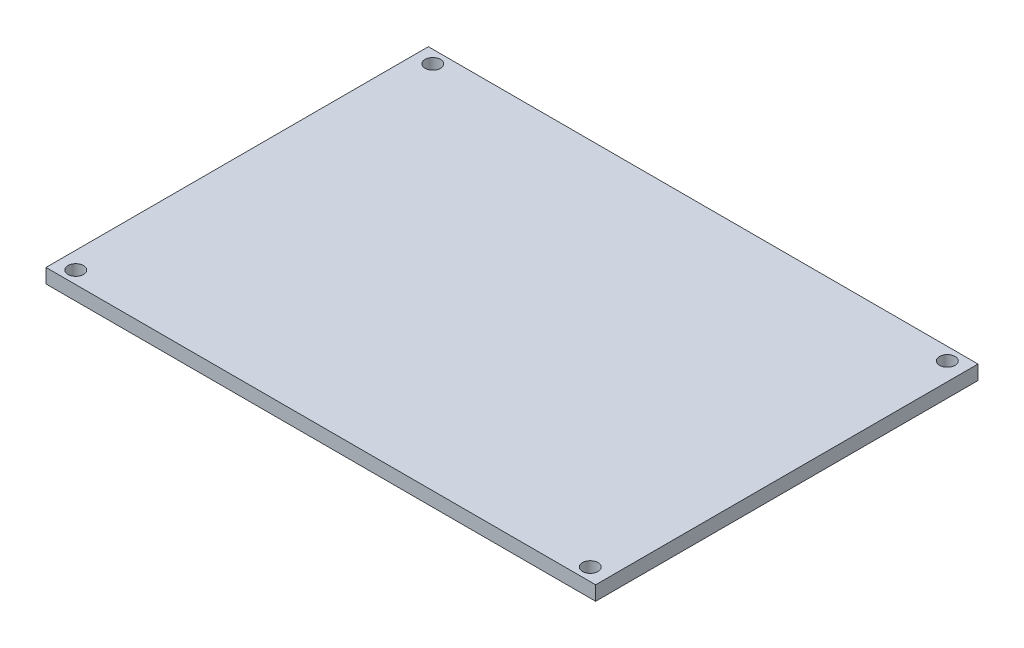
from build123d import *

# Parameters (mm, degrees)
SKETCH_1_W             = 115
SKETCH_1_H             = 80
EXTRUDE_1_DEPTH        = 3
SKETCH_1_4_OUTSIDE_W   = 145.024
SKETCH_1_4_OUTSIDE_H   = 110.024
SKETCH_1_4_OUTSIDE_W_2 = 115
SKETCH_1_4_OUTSIDE_H_2 = 80
SKETCH_1_4_OUTSIDE_R   = 1.625
CUT_EXTRUDE_3_DEPTH    = 3


with BuildPart() as part:
    # 草图1 → 凸台-拉伸1 (new body)
    with BuildSketch(Plane(origin=(0, 0, 0), x_dir=(1, 0, 0), z_dir=(0, 1, 0))):
        Rectangle(SKETCH_1_W, SKETCH_1_H)
    extrude(amount=EXTRUDE_1_DEPTH)

    # 草图1<4> outside → 切除-拉伸3 (cut)
    # profile 1 of 5: a face of its own
    with BuildSketch(Plane(origin=(0, 0, 0), x_dir=(1, 0, 0), z_dir=(0, 1, 0))):
        Rectangle(SKETCH_1_4_OUTSIDE_W, SKETCH_1_4_OUTSIDE_H)
        Rectangle(SKETCH_1_4_OUTSIDE_W_2, SKETCH_1_4_OUTSIDE_H_2, mode=Mode.SUBTRACT)
    # profile 2 of 5: a face of its own
    with BuildSketch(Plane(origin=(0, 0, 0), x_dir=(1, 0, 0), z_dir=(0, 1, 0))):
        with Locations((-53.925, 37.35)):
            Circle(SKETCH_1_4_OUTSIDE_R)
    # profile 3 of 5: a face of its own
    with BuildSketch(Plane(origin=(0, 0, 0), x_dir=(1, 0, 0), z_dir=(0, 1, 0))):
        with Locations((53.725, 37.35)):
            Circle(SKETCH_1_4_OUTSIDE_R)
    # profile 4 of 5: a face of its own
    with BuildSketch(Plane(origin=(0, 0, 0), x_dir=(1, 0, 0), z_dir=(0, 1, 0))):
        with Locations((-53.925, -37.35)):
            Circle(SKETCH_1_4_OUTSIDE_R)
    # profile 5 of 5: a face of its own
    with BuildSketch(Plane(origin=(0, 0, 0), x_dir=(1, 0, 0), z_dir=(0, 1, 0))):
        with Locations((53.725, -37.35)):
            Circle(SKETCH_1_4_OUTSIDE_R)
    extrude(amount=CUT_EXTRUDE_3_DEPTH, mode=Mode.SUBTRACT)


solid = part.part
